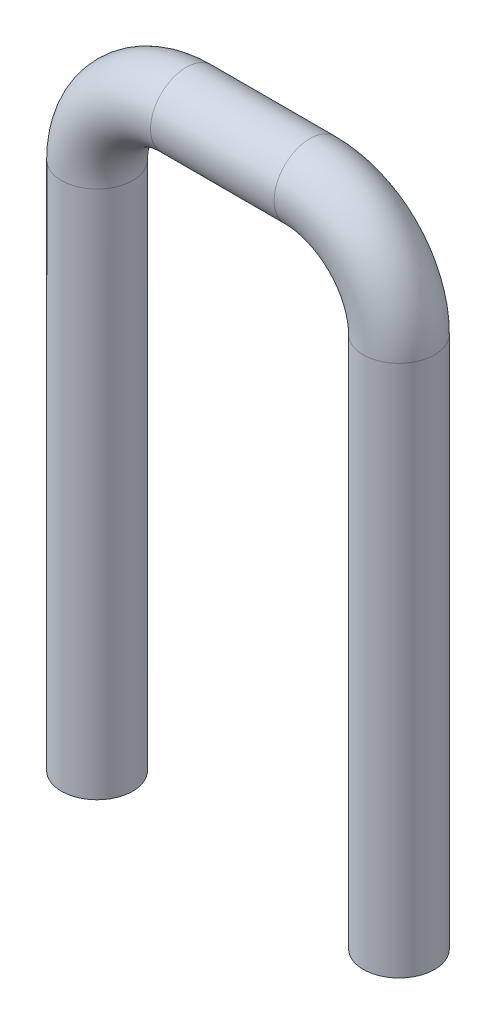
from build123d import *

# Parameters (mm, degrees)
SKETCH2_R           = 0.3
SKETCH4_R           = 0.3
BOSS_EXTRUDE1_DEPTH = 2.6
BOSS_EXTRUDE2_START = 2.6
SKETCH5_R           = 0.3
BOSS_EXTRUDE2_DEPTH = 2.6


with BuildPart() as part:
    # Sweep1: sweep along a path in Sketch1
    with BuildLine(Plane.XY) as sweep1_path:
        Line((0, 0), (0, 1.85))
        ThreePointArc((0, 1.85), (0.219669914, 2.380330086), (0.75, 2.6))
        Line((0.75, 2.6), (1.79, 2.6))
        ThreePointArc((1.79, 2.6), (2.320330086, 2.380330086), (2.54, 1.85))
        Line((2.54, 1.85), (2.54, -0.028529553))
    # Sketch2 → Sweep1 (sweep)
    with BuildSketch(Plane(origin=(0, 0, 0), x_dir=(1, 0, 0), z_dir=(0, 1, 0))):
        Circle(SKETCH2_R)
    sweep(path=sweep1_path.line)

    # Sketch4 → Boss-Extrude1 (add)
    with BuildSketch(Plane.XZ):
        with Locations(Location((0, 0, 0), (0, 0, 180))):
            Circle(SKETCH4_R)
    extrude(amount=BOSS_EXTRUDE1_DEPTH)

    # Sketch5 → Boss-Extrude2 (add)
    with BuildSketch(Plane.XZ.offset(0.028529553).offset(BOSS_EXTRUDE2_START)):
        with Locations((2.54, 0)):
            Circle(SKETCH5_R)
    extrude(amount=-BOSS_EXTRUDE2_DEPTH)


solid = part.part
